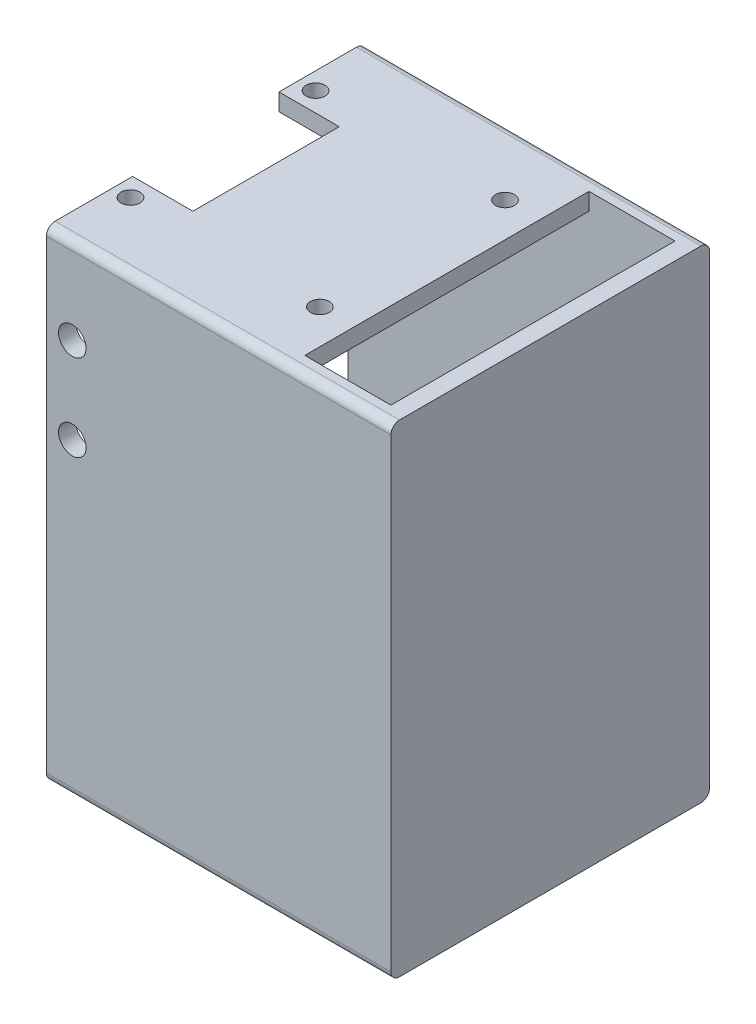
from build123d import *

# Parameters (mm, degrees)
SKETCH_1_W          = 40
SKETCH_1_H          = 37
EXTRUDE_1_DEPTH     = 51
SKETCH_3_W          = 33
SKETCH_3_H          = 47
CUT_EXTRUDE_2_DEPTH = 38
CUT_EXTRUDE_3_REACH = 59.821
SKETCH_4_W          = 10
SKETCH_4_H          = 33
CUT_EXTRUDE_4_REACH = 59.821
SKETCH_5_W          = 7
SKETCH_5_H          = 17
CUT_EXTRUDE_5_REACH = 59.821
SKETCH_6_R          = 1.1
SKETCH_7_W          = 37
SKETCH_7_H          = 5
EXTRUDE_2_DEPTH     = 40
SKETCH_9_R          = 1.6
SKETCH_9_R_2        = 1.1
CUT_EXTRUDE_6_DEPTH = 5
CUT_EXTRUDE_7_REACH = 68.106
SKETCH_12_R         = 1.6
FILLET_1_R          = 1


with BuildPart() as part:
    # 草图1 → 凸台-拉伸1 (new body)
    with BuildSketch(Plane(origin=(0, 0, 0), x_dir=(1, 0, 0), z_dir=(0, 1, 0))):
        Rectangle(SKETCH_1_W, SKETCH_1_H)
    extrude(amount=EXTRUDE_1_DEPTH)

    # 草图3 → 切除-拉伸2 (cut)
    with BuildSketch(Plane.ZY.offset(20)):
        with Locations((0, 25.5)):
            Rectangle(SKETCH_3_W, SKETCH_3_H)
    extrude(amount=-CUT_EXTRUDE_2_DEPTH, mode=Mode.SUBTRACT)

    # 草图4 → 切除-拉伸3 (cut, up to next)
    with BuildSketch(Plane(origin=(0, 51, 0), x_dir=(1, 0, 0), z_dir=(0, 1, 0)), mode=Mode.PRIVATE) as cut_extrude_3_sk1:
        with Locations((13, 0)):
            Rectangle(SKETCH_4_W, SKETCH_4_H)
    cut_extrude_3_tool1 = extrude(cut_extrude_3_sk1.sketch, amount=-CUT_EXTRUDE_3_REACH, mode=Mode.PRIVATE) & part.part
    add(cut_extrude_3_tool1.solids().sort_by_distance((13, 51, 0))[0], mode=Mode.SUBTRACT)

    # 草图5 → 切除-拉伸4 (cut, up to next)
    with BuildSketch(Plane(origin=(0, 51, 0), x_dir=(1, 0, 0), z_dir=(0, 1, 0)), mode=Mode.PRIVATE) as cut_extrude_4_sk1:
        with Locations((-16.5, 0)):
            Rectangle(SKETCH_5_W, SKETCH_5_H)
    cut_extrude_4_tool1 = extrude(cut_extrude_4_sk1.sketch, amount=-CUT_EXTRUDE_4_REACH, mode=Mode.PRIVATE) & part.part
    add(cut_extrude_4_tool1.solids().sort_by_distance((-16.5, 51, 0))[0], mode=Mode.SUBTRACT)

    # 草图6 → 切除-拉伸5 (cut, up to next)
    with BuildSketch(Plane(origin=(0, 51, 0), x_dir=(1, 0, 0), z_dir=(0, 1, 0)), mode=Mode.PRIVATE) as cut_extrude_5_sk1:
        with Locations(Location((-18, 10.75, 0), (0, 0, 270))):
            Circle(SKETCH_6_R)
    cut_extrude_5_tool1 = extrude(cut_extrude_5_sk1.sketch, amount=-CUT_EXTRUDE_5_REACH, mode=Mode.PRIVATE) & part.part
    # 草图6 → 切除-拉伸5 (cut, up to next)
    with BuildSketch(Plane(origin=(0, 51, 0), x_dir=(1, 0, 0), z_dir=(0, 1, 0)), mode=Mode.PRIVATE) as cut_extrude_5_sk2:
        with Locations(Location((-18, -10.75, 0), (0, 0, 270))):
            Circle(SKETCH_6_R)
    cut_extrude_5_tool2 = extrude(cut_extrude_5_sk2.sketch, amount=-CUT_EXTRUDE_5_REACH, mode=Mode.PRIVATE) & part.part
    # 草图6 → 切除-拉伸5 (cut, up to next)
    with BuildSketch(Plane(origin=(0, 51, 0), x_dir=(1, 0, 0), z_dir=(0, 1, 0)), mode=Mode.PRIVATE) as cut_extrude_5_sk3:
        with Locations(Location((4, 10.75, 0), (0, 0, 270))):
            Circle(SKETCH_6_R)
    cut_extrude_5_tool3 = extrude(cut_extrude_5_sk3.sketch, amount=-CUT_EXTRUDE_5_REACH, mode=Mode.PRIVATE) & part.part
    # 草图6 → 切除-拉伸5 (cut, up to next)
    with BuildSketch(Plane(origin=(0, 51, 0), x_dir=(1, 0, 0), z_dir=(0, 1, 0)), mode=Mode.PRIVATE) as cut_extrude_5_sk4:
        with Locations(Location((4, -10.75, 0), (0, 0, 270))):
            Circle(SKETCH_6_R)
    cut_extrude_5_tool4 = extrude(cut_extrude_5_sk4.sketch, amount=-CUT_EXTRUDE_5_REACH, mode=Mode.PRIVATE) & part.part
    add(cut_extrude_5_tool1.solids().sort_by_distance((-18, 51, -10.75))[0], mode=Mode.SUBTRACT)
    add(cut_extrude_5_tool2.solids().sort_by_distance((-18, 51, 10.75))[0], mode=Mode.SUBTRACT)
    add(cut_extrude_5_tool3.solids().sort_by_distance((4, 51, -10.75))[0], mode=Mode.SUBTRACT)
    add(cut_extrude_5_tool4.solids().sort_by_distance((4, 51, 10.75))[0], mode=Mode.SUBTRACT)

    # 草图7 → 凸台-拉伸2 (add)
    with BuildSketch(Plane.ZY.offset(20)):
        with Locations((0, -2.5)):
            Rectangle(SKETCH_7_W, SKETCH_7_H)
    extrude(amount=-EXTRUDE_2_DEPTH)

    # 草图9 → 切除-拉伸6 (cut)
    with BuildSketch(Plane.ZY.offset(20)):
        with Locations((-10, -2)):
            Circle(SKETCH_9_R)
        with Locations(Location((10, -2, 0), (0, 0, 180))):
            Circle(SKETCH_9_R)
        with Locations((-15.5, -2)):
            Circle(SKETCH_9_R_2)
        with Locations(Location((15.5, -2, 0), (0, 0, 180))):
            Circle(SKETCH_9_R_2)
    extrude(amount=-CUT_EXTRUDE_6_DEPTH, mode=Mode.SUBTRACT)

    # 切除-拉伸7: up to this face of the body (flat: up to its plane)
    cut_extrude_7_end = Plane(part.part.faces().sort_by_distance((0, 23, 18.5))[0])
    # 草图12 → 切除-拉伸7 (cut, up to the picked face)
    with BuildSketch(Plane(origin=(0, 0, -18.5), x_dir=(-1, 0, 0), z_dir=(0, 0, -1)), mode=Mode.PRIVATE) as cut_extrude_7_sk1:
        with Locations((17, 41)):
            Circle(SKETCH_12_R)
    cut_extrude_7_tool1 = split(extrude(cut_extrude_7_sk1.sketch, amount=-CUT_EXTRUDE_7_REACH, mode=Mode.PRIVATE), bisect_by=cut_extrude_7_end, keep=Keep.BOTH, mode=Mode.PRIVATE)
    # 草图12 → 切除-拉伸7 (cut, up to the picked face)
    with BuildSketch(Plane(origin=(0, 0, -18.5), x_dir=(-1, 0, 0), z_dir=(0, 0, -1)), mode=Mode.PRIVATE) as cut_extrude_7_sk2:
        with Locations((17, 31)):
            Circle(SKETCH_12_R)
    cut_extrude_7_tool2 = split(extrude(cut_extrude_7_sk2.sketch, amount=-CUT_EXTRUDE_7_REACH, mode=Mode.PRIVATE), bisect_by=cut_extrude_7_end, keep=Keep.BOTH, mode=Mode.PRIVATE)
    add(cut_extrude_7_tool1.solids().sort_by(Axis((-17, 41, -18.5), (0, 0, 1)))[0], mode=Mode.SUBTRACT)
    add(cut_extrude_7_tool2.solids().sort_by(Axis((-17, 31, -18.5), (0, 0, 1)))[0], mode=Mode.SUBTRACT)

    # 圆角1
    fillet_1_edges = [part.edges().sort_by_distance(p)[0] for p in [
        (0, 51, 18.5),
        (0, -5, -18.5),
        (0, -5, 18.5),
        (0, 51, -18.5),
    ]]
    fillet(fillet_1_edges, radius=FILLET_1_R)


solid = part.part
